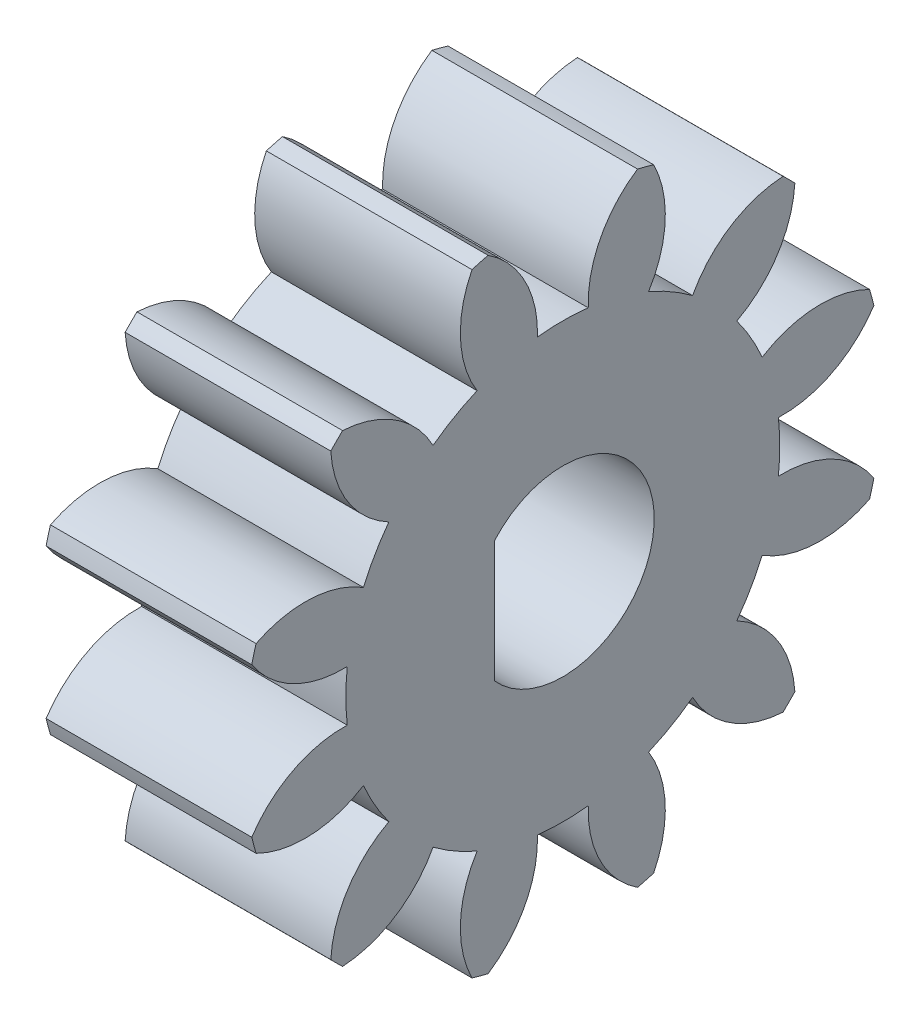
from build123d import *

# Parameters (mm, degrees)
BASPROSKE_W                 = 9
BASPROSKE_H                 = 14
TOOTHCUT_DEPTH              = 22.748563171
TEETHCUTS_COUNT             = 12
TEETHCUTS_ANGLE             = 330
BORSKE_R                    = 4
BORE_DEPTH                  = 50.0000508
DODANIE_WYCI_GNI_CIE1_START = 9
DODANIE_WYCI_GNI_CIE1_DEPTH = 9


with BuildPart() as part:
    # BasProSke → Base-Revolve (revolve)
    with BuildSketch(Plane(origin=(0, 0, 0), x_dir=(1, 0, 0), z_dir=(0, 1, 0)), mode=Mode.PRIVATE) as base_revolve_sk:
        with Locations((4.5, 7)):
            Rectangle(BASPROSKE_W, BASPROSKE_H)
    revolve(base_revolve_sk.sketch.rotate(Axis((-10, 0, 0), (1, 0, 0)), 180), axis=Axis((-10, 0, 0), (1, 0, 0)))

    # TooCutSke → ToothCut (cut, through all)
    with BuildSketch(Plane(origin=(0, 0, 0), x_dir=(0, 0, -1), z_dir=(1, 0, 0))):
        with BuildLine():
            ThreePointArc((1.111908866, 9.433698091), (0, 9.499), (-1.111908866, 9.433698091))
            ThreePointArc((-1.111908866, 9.433698091), (-1.651516138, 11.821129337), (-3.298149691, 13.632096456))
            ThreePointArc((-3.298149691, 13.632096456), (0, 14.0254), (3.298149691, 13.632096456))
            ThreePointArc((3.298149691, 13.632096456), (1.651516138, 11.821129337), (1.111908866, 9.433698091))
        make_face()
    toothcut = extrude(amount=TOOTHCUT_DEPTH, mode=Mode.SUBTRACT)

    # TeethCuts: ToothCut ×12 about axis
    teethcuts_axis = Axis((-10, 0, 0), (1, 0, 0))
    for i in range(1, TEETHCUTS_COUNT):
        add(toothcut.rotate(teethcuts_axis, i * TEETHCUTS_ANGLE / (TEETHCUTS_COUNT - 1)), mode=Mode.SUBTRACT)

    # BorSke → Bore (cut, symmetric)
    with BuildSketch(Plane(origin=(0, 0, 0), x_dir=(0, 0, -1), z_dir=(1, 0, 0))):
        with Locations(Location((0, 0, 0), (0, 0, 180))):
            Circle(BORSKE_R)
    extrude(amount=BORE_DEPTH, both=True, mode=Mode.SUBTRACT)

    # Szkic1 → Dodanie-wyciągnięcie1 (add)
    with BuildSketch(Plane(origin=(0, 0, 0), x_dir=(0, 0, -1), z_dir=(1, 0, 0)).offset(DODANIE_WYCI_GNI_CIE1_START)):
        with BuildLine():
            ThreePointArc((-3, 2.645751311), (-4, 0), (-3, -2.645751311))
            Line((-3, -2.645751311), (-3, 2.645751311))
        make_face()
    extrude(amount=-DODANIE_WYCI_GNI_CIE1_DEPTH)


solid = part.part
